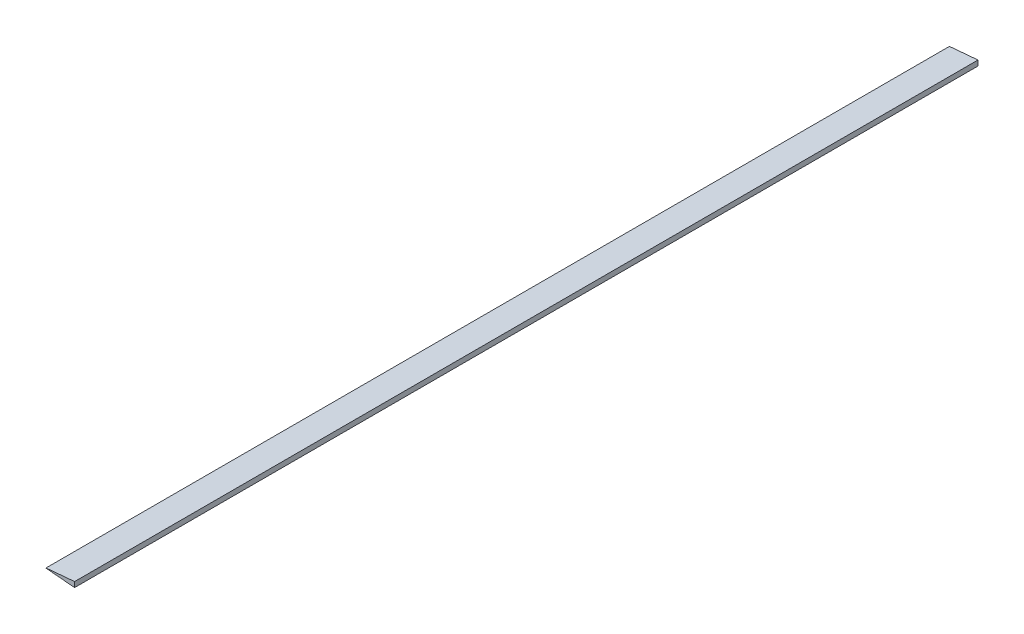
from build123d import *

# Parameters (mm, degrees)
BOSS_EXTRUDE1_DEPTH = 422.9


with BuildPart() as part:
    # Sketch1 → Boss-Extrude1 (new, symmetric)
    with BuildSketch(Plane.XY):
        with BuildLine():
            Line((-62.4953, 2.452594733), (-62.4953, -2.452594733))
            add(Edge.make_bspline(
                [(-62.4953, -2.452594733), (-62.595541239, -2.445521659), (-64.084046323, -2.340491977), (-66.878351121, -2.124092935), (-70.782790818, -1.812374654), (-74.400650142, -1.50629894), (-77.692474662, -1.215339637), (-80.622150765, -0.945556494), (-83.157591059, -0.703590248), (-85.271018328, -0.495574614), (-86.939286597, -0.327147858), (-88.144124904, -0.203082754), (-88.872347289, -0.12711663), (-89.197487285, -0.0929374), (-89.279, -0.084368655)],
                knots=[0, 0, 0, 0, 0.011211572, 0.166483201, 0.31268616, 0.448210553, 0.571562716, 0.681381362, 0.776452467, 0.855722863, 0.918312437, 0.963524724, 0.990855635, 1, 1, 1, 1], degree=3))
            Line((-89.279, -0.084368655), (-89.279, 0.084368655))
            add(Edge.make_bspline(
                [(-62.4953, 2.452594733), (-62.595541239, 2.445521659), (-64.084046323, 2.340491977), (-66.878351121, 2.124092935), (-70.782790818, 1.812374654), (-74.400650142, 1.50629894), (-77.692474662, 1.215339637), (-80.622150765, 0.945556494), (-83.157591059, 0.703590248), (-85.271018328, 0.495574614), (-86.939286597, 0.327147858), (-88.144124904, 0.203082754), (-88.872347289, 0.12711663), (-89.197487285, 0.0929374), (-89.279, 0.084368655)],
                knots=[0, 0, 0, 0, 0.011211572, 0.166483201, 0.31268616, 0.448210553, 0.571562716, 0.681381362, 0.776452467, 0.855722863, 0.918312437, 0.963524724, 0.990855635, 1, 1, 1, 1], degree=3))
        make_face()
    extrude(amount=BOSS_EXTRUDE1_DEPTH, both=True)


solid = part.part
